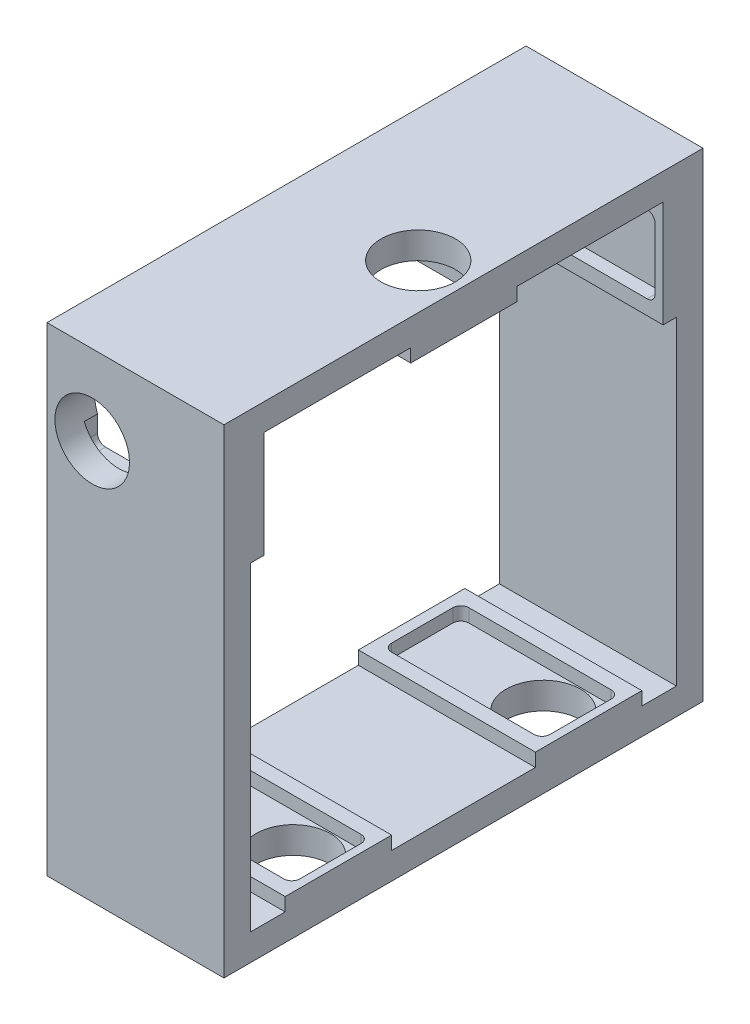
from build123d import *

# Parameters (mm, degrees)
SKETCH1_W                = 66.5
SKETCH1_H                = 180
BOSS_EXTRUDE1_DEPTH      = 180
SKETCH3_W                = 160
SKETCH3_H                = 160
CUT_EXTRUDE1_DEPTH       = 180
SKETCH8_W                = 66.5
SKETCH8_H                = 40
BOSS_EXTRUDE2_DEPTH      = 5
SKETCH10_W               = 66.5
SKETCH10_H               = 40
BOSS_EXTRUDE3_DEPTH      = 5
SKETCH5_R                = 14
CUT_EXTRUDE3_DEPTH       = 10
CUT_EXTRUDE5_DEPTH       = 5
CUT_EXTRUDE6_START       = -5
CUT_EXTRUDE6_DEPTH       = 5
SKETCH12_W               = 66.5
SKETCH12_H               = 40
BOSS_EXTRUDE8_DEPTH      = 5
SKETCH15_R               = 14
CUT_EXTRUDE7_DEPTH       = 200
SKETCH7_R                = 14
CORTE_EXTRUS_O1_DEPTH    = 10
SKETCH13_W               = 66.5
SKETCH13_H               = 40
RESSALTO_EXTRUS_O1_DEPTH = 5


with BuildPart() as part:
    # Sketch1 → Boss-Extrude1 (new body)
    with BuildSketch(Plane.XY):
        with Locations((33.25, 90)):
            Rectangle(SKETCH1_W, SKETCH1_H)
    extrude(amount=BOSS_EXTRUDE1_DEPTH)

    # Sketch3 → Cut-Extrude1 (cut)
    with BuildSketch(Plane.ZY):
        with Locations((90, 90)):
            Rectangle(SKETCH3_W, SKETCH3_H)
    extrude(amount=-CUT_EXTRUDE1_DEPTH, mode=Mode.SUBTRACT)

    # Sketch8 → Boss-Extrude2 (add)
    with BuildSketch(Plane.XY.offset(10)):
        with Locations((33.25, 150)):
            Rectangle(SKETCH8_W, SKETCH8_H)
    extrude(amount=BOSS_EXTRUDE2_DEPTH)

    # Sketch10 → Boss-Extrude3 (add)
    with BuildSketch(Plane(origin=(0, 0, 170), x_dir=(-1, 0, 0), z_dir=(0, 0, -1))):
        with Locations((-33.25, 150)):
            Rectangle(SKETCH10_W, SKETCH10_H)
    extrude(amount=BOSS_EXTRUDE3_DEPTH)

    # Sketch5 → Cut-Extrude3 (cut)
    with BuildSketch(Plane(origin=(0, 180, 0), x_dir=(1, 0, 0), z_dir=(0, 1, 0))):
        with Locations(Location((49.5, -90, 0), (0, 0, 270))):
            Circle(SKETCH5_R)
    extrude(amount=-CUT_EXTRUDE3_DEPTH, mode=Mode.SUBTRACT)

    # Sketch9 → Cut-Extrude5 (cut)
    with BuildSketch(Plane.XY.offset(15)):
        with BuildLine():
            Line((60.5, 164.5), (7.5, 164.5))
            ThreePointArc((7.5, 164.5), (5.378679656, 163.621320344), (4.5, 161.5))
            Line((4.5, 161.5), (4.5, 138.5))
            ThreePointArc((4.5, 138.5), (5.378679656, 136.378679656), (7.5, 135.5))
            Line((7.5, 135.5), (60.5, 135.5))
            ThreePointArc((60.5, 135.5), (62.621320344, 136.378679656), (63.5, 138.5))
            Line((63.5, 138.5), (63.5, 161.5))
            ThreePointArc((63.5, 161.5), (62.621320344, 163.621320344), (60.5, 164.5))
        make_face()
    extrude(amount=-CUT_EXTRUDE5_DEPTH, mode=Mode.SUBTRACT)

    # Sketch11 → Cut-Extrude6 (cut)
    with BuildSketch(Plane(origin=(0, 0, 165), x_dir=(-1, 0, 0), z_dir=(0, 0, -1)).offset(CUT_EXTRUDE6_START)):
        with BuildLine():
            Line((-60.5, 164.5), (-7, 164.5))
            ThreePointArc((-7, 164.5), (-4.878679656, 163.621320344), (-4, 161.5))
            Line((-4, 161.5), (-4, 138.5))
            ThreePointArc((-4, 138.5), (-4.878679656, 136.378679656), (-7, 135.5))
            Line((-7, 135.5), (-60.5, 135.5))
            ThreePointArc((-60.5, 135.5), (-62.621320344, 136.378679656), (-63.5, 138.5))
            Line((-63.5, 138.5), (-63.5, 161.5))
            ThreePointArc((-63.5, 161.5), (-62.621320344, 163.621320344), (-60.5, 164.5))
        make_face()
    extrude(amount=CUT_EXTRUDE6_DEPTH, mode=Mode.SUBTRACT)

    # Sketch12 → Boss-Extrude8 (add)
    with BuildSketch(Plane.XZ.offset(-170)):
        with Locations((33.25, 89.833476808)):
            Rectangle(SKETCH12_W, SKETCH12_H)
        with BuildLine():
            Line((60.5, 75.333476808), (7, 75.333476808))
            ThreePointArc((7, 75.333476808), (4.878679656, 76.212156465), (4, 78.333476808))
            Line((4, 78.333476808), (4, 101.333476808))
            ThreePointArc((4, 101.333476808), (4.878679656, 103.454797152), (7, 104.333476808))
            Line((7, 104.333476808), (60.5, 104.333476808))
            ThreePointArc((60.5, 104.333476808), (62.621320344, 103.454797152), (63.5, 101.333476808))
            Line((63.5, 101.333476808), (63.5, 78.333476808))
            ThreePointArc((63.5, 78.333476808), (62.621320344, 76.212156465), (60.5, 75.333476808))
        make_face(mode=Mode.SUBTRACT)
    extrude(amount=BOSS_EXTRUDE8_DEPTH)

    # Sketch15 → Cut-Extrude7 (cut)
    with BuildSketch(Plane(origin=(0, 0, 0), x_dir=(-1, 0, 0), z_dir=(0, 0, -1))):
        with Locations((-17, 150)):
            Circle(SKETCH15_R)
    extrude(amount=-CUT_EXTRUDE7_DEPTH, mode=Mode.SUBTRACT)

    # Sketch7 → Corte-extrusão1 (cut)
    with BuildSketch(Plane.XZ):
        with Locations(Location((49.5, 43, 0), (0, 0, 270))):
            Circle(SKETCH7_R)
        with Locations(Location((49.5, 137, 0), (0, 0, 270))):
            Circle(SKETCH7_R)
    extrude(amount=-CORTE_EXTRUS_O1_DEPTH, mode=Mode.SUBTRACT)

    # Sketch13 → Ressalto-extrusão1 (add)
    # profile 1 of 2: a face of its own
    with BuildSketch(Plane(origin=(0, 10, 0), x_dir=(1, 0, 0), z_dir=(0, 1, 0))):
        with Locations((33.25, -43)):
            Rectangle(SKETCH13_W, SKETCH13_H)
        with BuildLine():
            Line((7, -57.5), (60.5, -57.5))
            ThreePointArc((60.5, -57.5), (62.621320344, -56.621320344), (63.5, -54.5))
            Line((63.5, -54.5), (63.5, -31.5))
            ThreePointArc((63.5, -31.5), (62.621320344, -29.378679656), (60.5, -28.5))
            Line((60.5, -28.5), (7, -28.5))
            ThreePointArc((7, -28.5), (4.878679656, -29.378679656), (4, -31.5))
            Line((4, -31.5), (4, -54.5))
            ThreePointArc((4, -54.5), (4.878679656, -56.621320344), (7, -57.5))
        make_face(mode=Mode.SUBTRACT)
    # profile 2 of 2: a face of its own
    with BuildSketch(Plane(origin=(0, 10, 0), x_dir=(1, 0, 0), z_dir=(0, 1, 0))):
        with Locations((33.25, -137)):
            Rectangle(SKETCH13_W, SKETCH13_H)
        with BuildLine():
            Line((7, -151.5), (60.5, -151.5))
            ThreePointArc((60.5, -151.5), (62.621320344, -150.621320344), (63.5, -148.5))
            Line((63.5, -148.5), (63.5, -125.5))
            ThreePointArc((63.5, -125.5), (62.621320344, -123.378679656), (60.5, -122.5))
            Line((60.5, -122.5), (7, -122.5))
            ThreePointArc((7, -122.5), (4.878679656, -123.378679656), (4, -125.5))
            Line((4, -125.5), (4, -148.5))
            ThreePointArc((4, -148.5), (4.878679656, -150.621320344), (7, -151.5))
        make_face(mode=Mode.SUBTRACT)
    extrude(amount=RESSALTO_EXTRUS_O1_DEPTH)


solid = part.part
